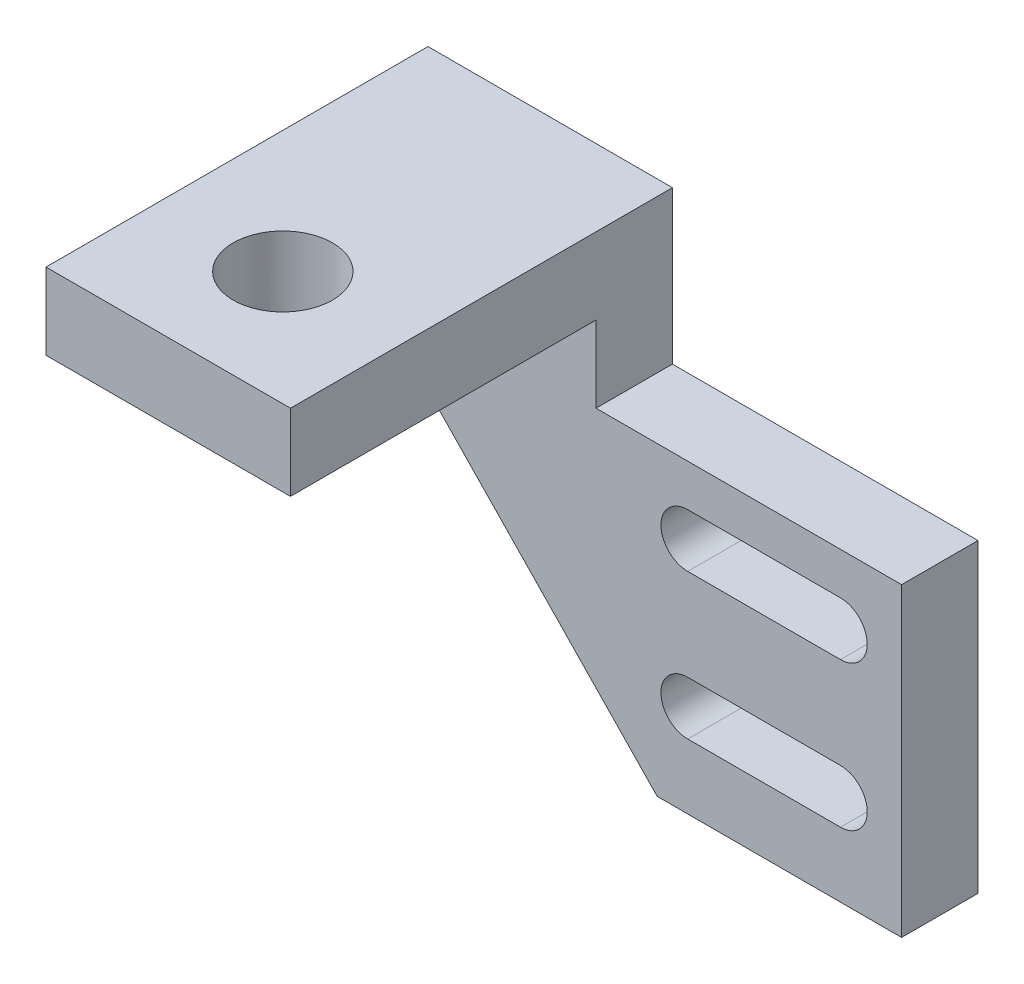
from build123d import *

# Parameters (mm, degrees)
ESTRUSIONE_ESTRUSIONE1_DEPTH = 5
SCHIZZO2_W                   = 16
SCHIZZO2_H                   = 5
ESTRUSIONE_ESTRUSIONE2_DEPTH = 20
TAGLIO_ESTRUSIONE1_REACH     = 42.62
SCHIZZO3_R                   = 3.25


with BuildPart() as part:
    # Schizzo1 → Estrusione-Estrusione1 (new body)
    with BuildSketch(Plane.XY):
        Polygon((-16, 0), (0, 0), (0, -10), (20, -10), (20, -30), (4, -30), (-16, -9.295201316), align=None)
        with BuildLine():
            Line((16, -22.25), (6, -22.25))
            ThreePointArc((6, -22.25), (4.25, -24), (6, -25.75))
            Line((6, -25.75), (16, -25.75))
            ThreePointArc((16, -25.75), (17.75, -24), (16, -22.25))
        make_face(mode=Mode.SUBTRACT)
        with BuildLine():
            Line((16, -12.75), (6, -12.75))
            ThreePointArc((6, -12.75), (4.25, -14.5), (6, -16.25))
            Line((6, -16.25), (16, -16.25))
            ThreePointArc((16, -16.25), (17.75, -14.5), (16, -12.75))
        make_face(mode=Mode.SUBTRACT)
    extrude(amount=ESTRUSIONE_ESTRUSIONE1_DEPTH)

    # Schizzo2 → Estrusione-Estrusione2 (add)
    with BuildSketch(Plane.XY.offset(5)):
        with Locations((-8, -2.5)):
            Rectangle(SCHIZZO2_W, SCHIZZO2_H)
    extrude(amount=ESTRUSIONE_ESTRUSIONE2_DEPTH)

    # Schizzo3 → Taglio-Estrusione1 (cut, up to next)
    with BuildSketch(Plane.XZ.offset(5), mode=Mode.PRIVATE) as taglio_estrusione1_sk1:
        with Locations((-8, 17.5)):
            Circle(SCHIZZO3_R)
    taglio_estrusione1_tool1 = extrude(taglio_estrusione1_sk1.sketch, amount=-TAGLIO_ESTRUSIONE1_REACH, mode=Mode.PRIVATE) & part.part
    add(taglio_estrusione1_tool1.solids().sort_by_distance((-8, -5, 17.5))[0], mode=Mode.SUBTRACT)


solid = part.part
